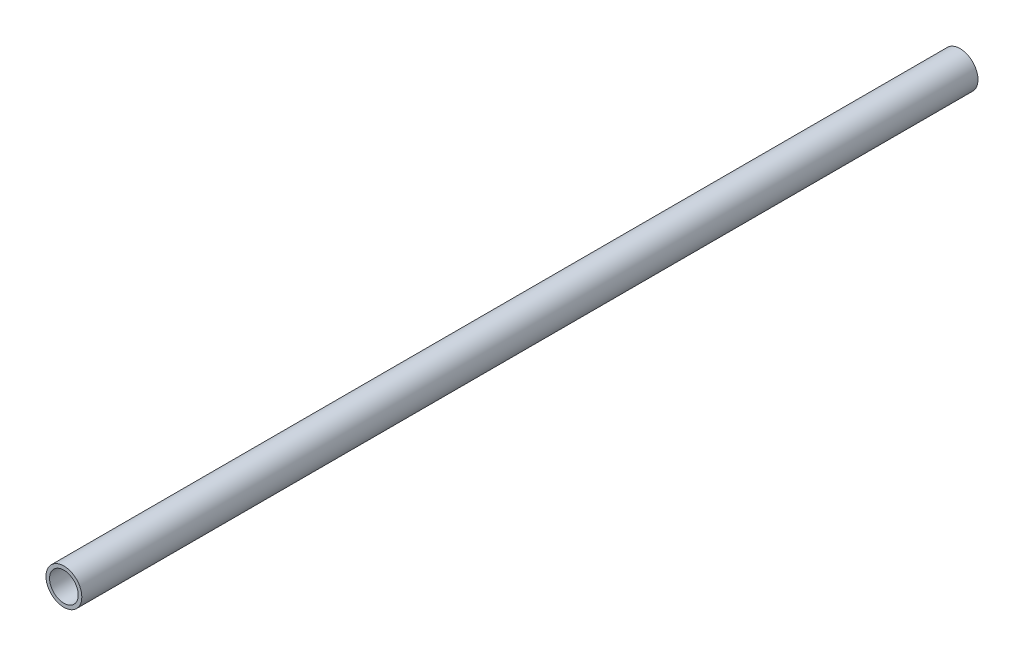
from build123d import *

# Parameters (mm, degrees)
SKETCH1_R           = 5
SKETCH1_R_2         = 4
BOSS_EXTRUDE1_DEPTH = 250


with BuildPart() as part:
    # Sketch1 → Boss-Extrude1 (new body)
    with BuildSketch(Plane.XY):
        Circle(SKETCH1_R)
        Circle(SKETCH1_R_2, mode=Mode.SUBTRACT)
    extrude(amount=BOSS_EXTRUDE1_DEPTH)


solid = part.part
